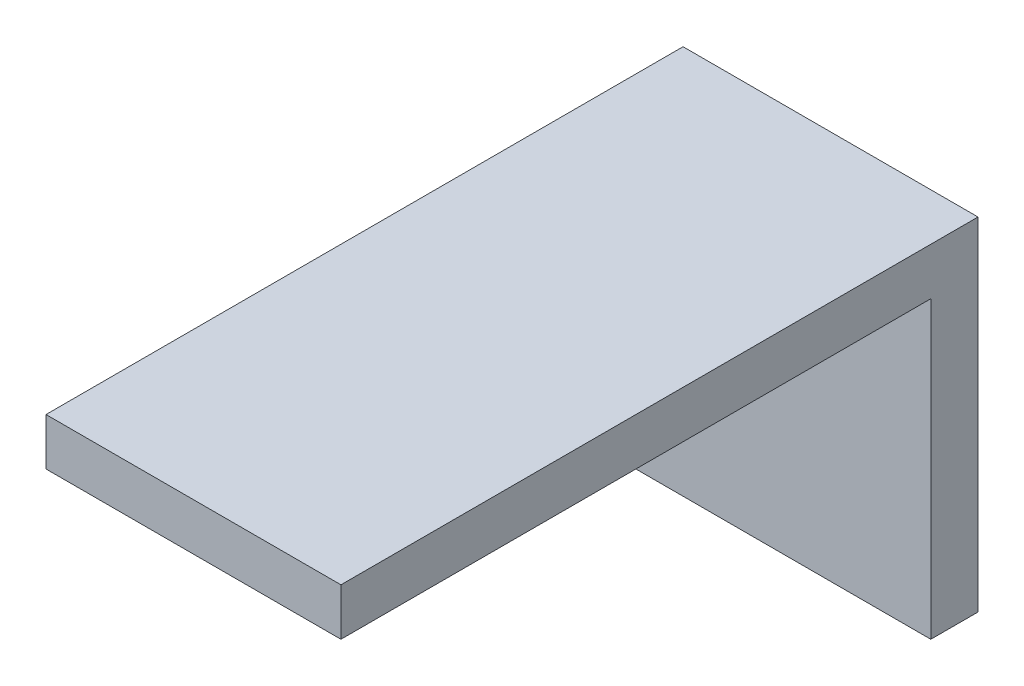
from build123d import *

# Parameters (mm, degrees)
PROFILE_EXTRUDE_DEPTH = 12.5


with BuildPart() as part:
    # Profile Sketch → Profile Extrude (new, symmetric)
    with BuildSketch(Plane(origin=(0, -31.892797, 3.642255972), x_dir=(0, 1, 0), z_dir=(1, 0, 0))):
        Polygon((31.892797, -3.642255972), (6.892797, -3.642255972), (6.892797, -7.642255972), (35.892797, -7.642255972), (35.892797, 46.357744028), (31.892797, 46.357744028), align=None)
    extrude(amount=PROFILE_EXTRUDE_DEPTH, both=True)


solid = part.part
